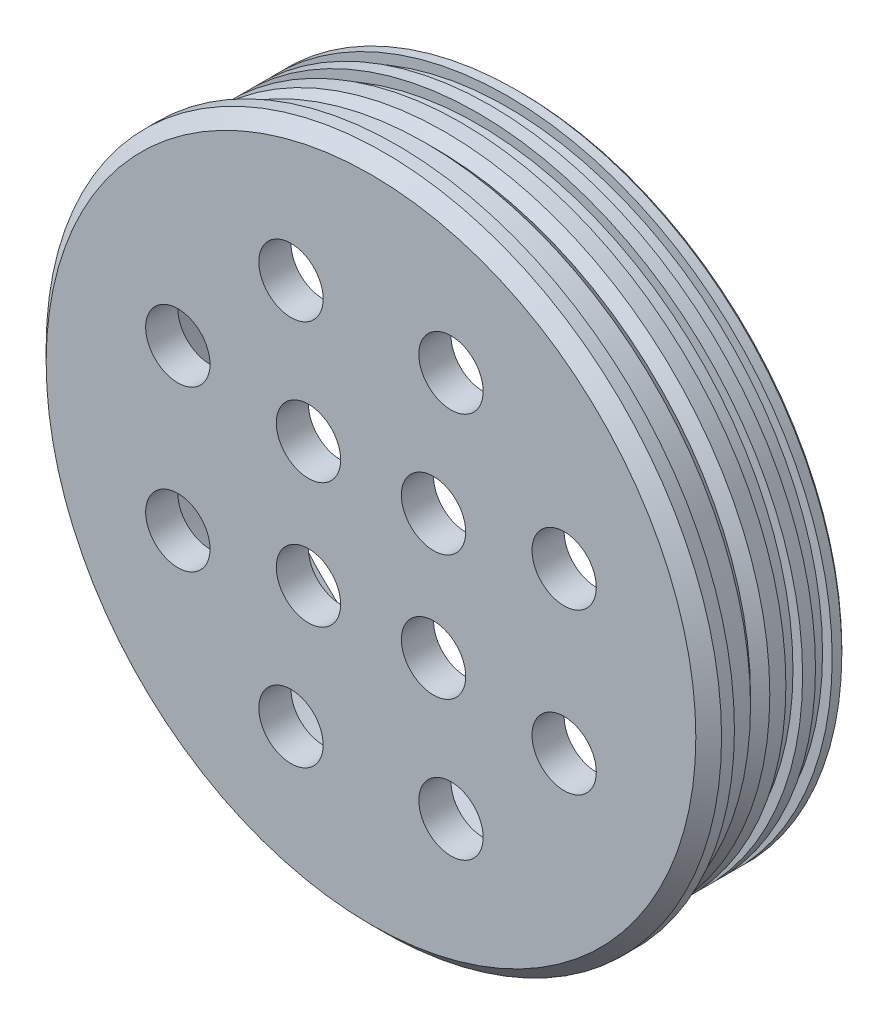
from build123d import *

# Parameters (mm, degrees)
CHAMFER_1_SIZE      = 2
SKETCH_4_R          = 5
CUT_EXTRUDE_2_DEPTH = 10
SKETCH_5_R          = 1.5
CUT_EXTRUDE_3_DEPTH = 10


with BuildPart() as part:
    # Эскиз2 → Повернуть1 (revolve)
    with BuildSketch(Plane(origin=(0, 0, 0), x_dir=(1, 0, 0), z_dir=(0, 1, 0)), mode=Mode.PRIVATE) as revolve_1_sk:
        Polygon((0, 0), (0, 5), (-43.5, 5), (-43.5, 23.2), (-50, 23.2), (-50.5, 22.7), (-50.5, 21.2), (-49, 21.2), (-49, 18.6), (-50.5, 18.6), (-50.5, 16.6), (-49, 16.6), (-49, 14), (-50.5, 14), (-50.5, 11.5), (-49, 10), (-50.5, 8.5), (-50.5, 4), (-52.5, 4), (-52.5, 0), (-18.386389901, 0), align=None)
    revolve(revolve_1_sk.sketch.rotate(Axis((0, 0, 0), (0, 0, -1)), 180), axis=Axis((0, 0, 0), (0, 0, -1)))

    # Фаска1
    chamfer_1_edges = [part.edges().sort_by_distance(p)[0] for p in [
        (-52.5, 0, 0),
    ]]
    chamfer(chamfer_1_edges, length=CHAMFER_1_SIZE)

    # Эскиз4 → Вырез-Вытянуть2 (cut)
    with BuildSketch(Plane.XY):
        with Locations((-12.437211552, -30.026084807)):
            Circle(SKETCH_4_R)
        with Locations((-30.026084807, 12.437211552)):
            Circle(SKETCH_4_R)
        with Locations((-12.437211552, 30.026084807)):
            Circle(SKETCH_4_R)
        with Locations((12.437211552, 30.026084807)):
            Circle(SKETCH_4_R)
        with Locations((30.026084807, 12.437211552)):
            Circle(SKETCH_4_R)
        with Locations((30.026084807, -12.437211552)):
            Circle(SKETCH_4_R)
        with Locations((12.437211552, -30.026084807)):
            Circle(SKETCH_4_R)
        with Locations((-30.026084807, -12.437211552)):
            Circle(SKETCH_4_R)
        with Locations((-9.722718241, 9.722718241)):
            Circle(SKETCH_4_R)
        with Locations((9.722718241, 9.722718241)):
            Circle(SKETCH_4_R)
        with Locations((9.722718241, -9.722718241)):
            Circle(SKETCH_4_R)
        with Locations((-9.722718241, -9.722718241)):
            Circle(SKETCH_4_R)
    extrude(amount=-CUT_EXTRUDE_2_DEPTH, mode=Mode.SUBTRACT)

    # Эскиз5 → Вырез-Вытянуть3 (cut)
    with BuildSketch(Plane(origin=(0, 0, -23.2), x_dir=(-1, 0, 0), z_dir=(0, 0, -1))):
        with Locations((0, 46.5)):
            Circle(SKETCH_5_R)
        with Locations((40.270181276, 23.25)):
            Circle(SKETCH_5_R)
        with Locations((40.270181276, -23.25)):
            Circle(SKETCH_5_R)
        with Locations((0, -46.5)):
            Circle(SKETCH_5_R)
        with Locations((-40.270181276, -23.25)):
            Circle(SKETCH_5_R)
        with Locations((-40.270181276, 23.25)):
            Circle(SKETCH_5_R)
    extrude(amount=-CUT_EXTRUDE_3_DEPTH, mode=Mode.SUBTRACT)


solid = part.part
